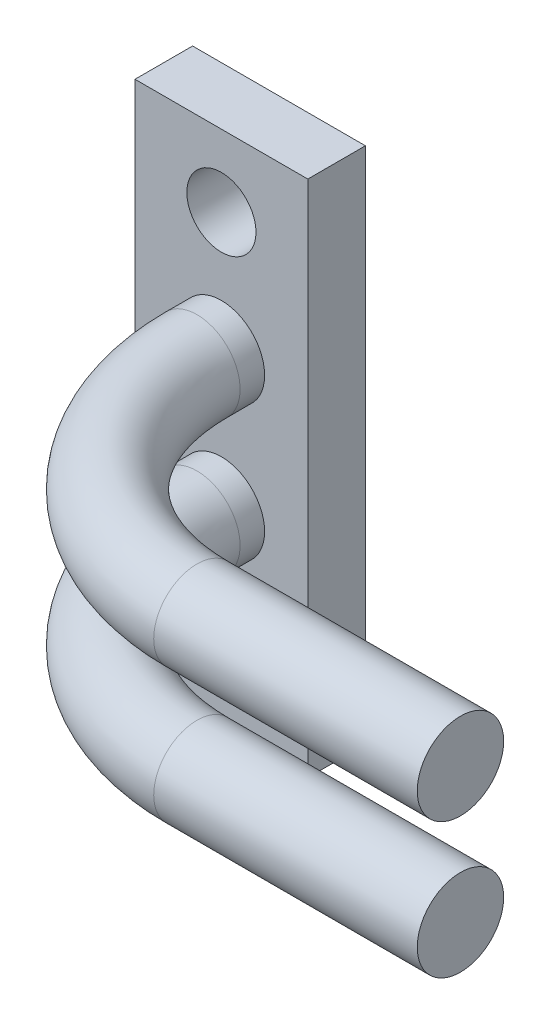
from build123d import *

# Parameters (mm, degrees)
SKETCH1_W           = 6
SKETCH1_H           = 18
BOSS_EXTRUDE1_DEPTH = 2
SKETCH2_R           = 1.5
BOSS_EXTRUDE2_DEPTH = 2.1
FILLET1_R           = 1.5
SKETCH3_R           = 1.5
SKETCH5_R           = 1.2
CUT_EXTRUDE1_DEPTH  = 22.33647117


with BuildPart() as part:
    # Sketch1 → Boss-Extrude1 (new body)
    with BuildSketch(Plane.XY):
        Rectangle(SKETCH1_W, SKETCH1_H)
    extrude(amount=BOSS_EXTRUDE1_DEPTH)

    # Sketch2 → Boss-Extrude2 (add)
    with BuildSketch(Plane(origin=(0, 0, 0), x_dir=(-1, 0, 0), z_dir=(0, 0, -1))):
        with Locations((0, 2.35)):
            Circle(SKETCH2_R)
        with Locations((0, -2.35)):
            Circle(SKETCH2_R)
    extrude(amount=BOSS_EXTRUDE2_DEPTH)

    # Fillet1
    fillet1_edges = [part.edges().sort_by_distance(p)[0] for p in [
        (1.5, 2.35, -2.1),
        (1.5, -2.35, -2.1),
    ]]
    fillet(fillet1_edges, radius=FILLET1_R)

    # Sweep1: sweep along a path in Sketch4
    with BuildLine(Plane(origin=(0, 2.35, 0), x_dir=(-1, 0, 0), z_dir=(0, 1, 0))) as sweep1_path:
        Line((0, 2), (0, 2.85))
        ThreePointArc((0, 2.85), (-2.196699141, 8.153300859), (-7.5, 10.35))
        Line((-7.5, 10.35), (-16.65, 10.35))
    # Sketch3 → Sweep1 (sweep)
    with BuildSketch(Plane.XY.offset(2)):
        with Locations((0, -2.35)):
            Circle(SKETCH3_R)
        with Locations((0, 2.35)):
            Circle(SKETCH3_R)
    sweep(path=sweep1_path.line)

    # Sketch5 → Cut-Extrude1 (cut, through all)
    with BuildSketch(Plane.XY.offset(2)):
        with Locations((0, 6.5)):
            Circle(SKETCH5_R)
        with Locations(Location((0, -6.5, 0), (0, 0, 180))):
            Circle(SKETCH5_R)
    extrude(amount=-CUT_EXTRUDE1_DEPTH, mode=Mode.SUBTRACT)


solid = part.part
